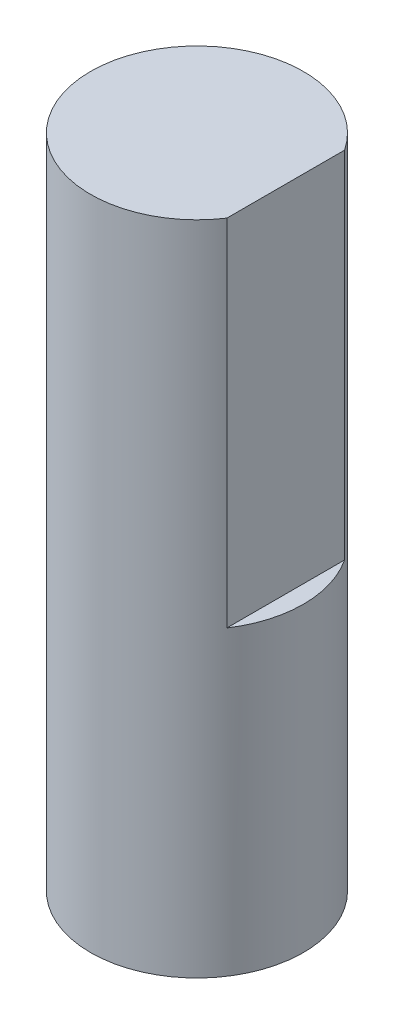
from build123d import *

# Parameters (mm, degrees)
SKETCH2_R           = 3
BOSS_EXTRUDE1_DEPTH = 18.5
CUT_EXTRUDE1_START  = -10
CUT_EXTRUDE1_DEPTH  = 10


with BuildPart() as part:
    # Sketch2 → Boss-Extrude1 (new body)
    with BuildSketch(Plane(origin=(0, 0, 0), x_dir=(1, 0, 0), z_dir=(0, 1, 0))):
        with Locations(Location((0, 0, 0), (0, 0, 270))):
            Circle(SKETCH2_R)
    extrude(amount=BOSS_EXTRUDE1_DEPTH)

    # Sketch3 → Cut-Extrude1 (cut)
    with BuildSketch(Plane(origin=(0, 18.5, 0), x_dir=(1, 0, 0), z_dir=(0, 1, 0)).offset(CUT_EXTRUDE1_START)):
        with BuildLine():
            Line((2.5, 1.658312395), (2.5, -1.658312395))
            ThreePointArc((2.5, -1.658312395), (3, 0), (2.5, 1.658312395))
        make_face()
    extrude(amount=CUT_EXTRUDE1_DEPTH, mode=Mode.SUBTRACT)


solid = part.part
